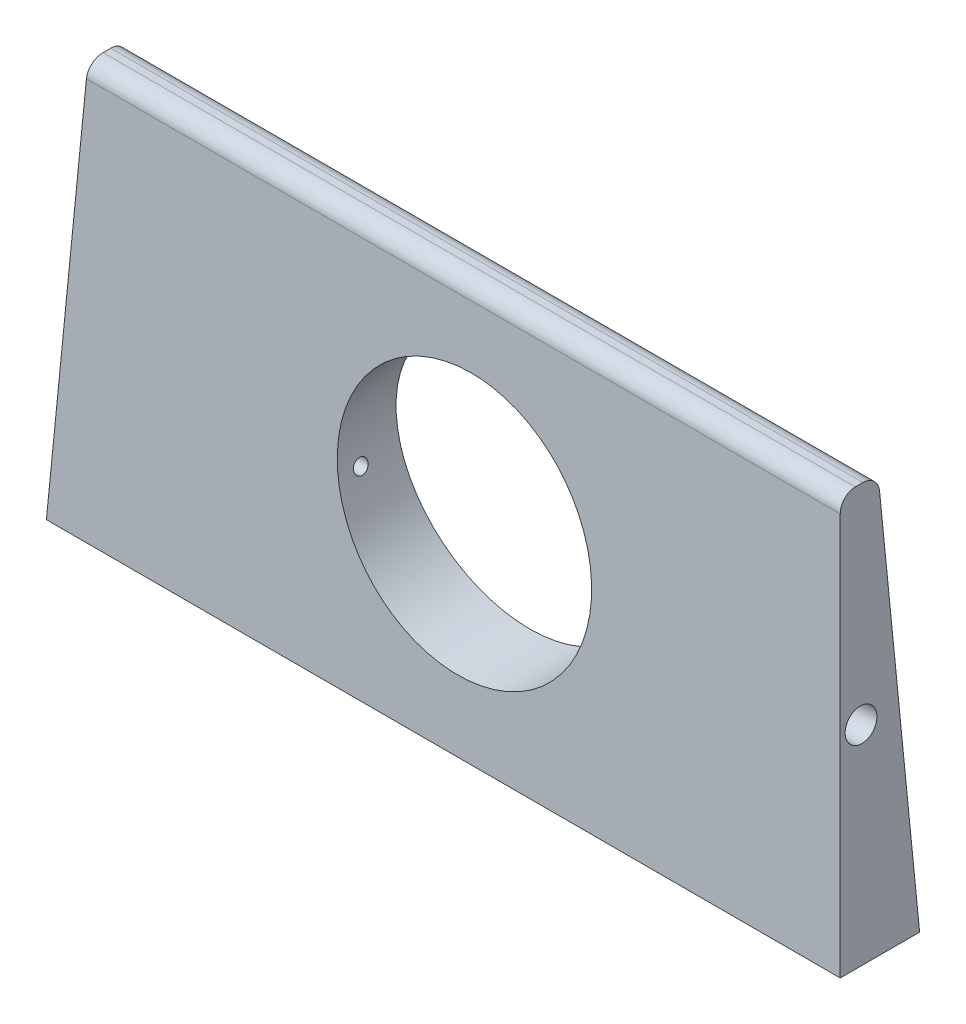
from build123d import *

# Parameters (mm, degrees)
SKETCH1_W           = 100
SKETCH1_H           = 10
BOSS_EXTRUDE1_DEPTH = 50
BOSS_EXTRUDE1_TAPER = 3
FILLET1_R           = 2
SKETCH2_R           = 16
CUT_EXTRUDE1_DEPTH  = 50
SKETCH3_R           = 2
CUT_EXTRUDE2_DEPTH  = 105
CUT_EXTRUDE2_DRAFT  = -1


with BuildPart() as part:
    # Sketch1 → Boss-Extrude1 (new body)
    with BuildSketch(Plane(origin=(0, 0, 0), x_dir=(1, 0, 0), z_dir=(0, 1, 0))):
        Rectangle(SKETCH1_W, SKETCH1_H)
    extrude(amount=BOSS_EXTRUDE1_DEPTH, taper=BOSS_EXTRUDE1_TAPER)

    # Fillet1
    fillet1_edges = [part.edges().sort_by_distance(p)[0] for p in [
        (0, 50, 2.379611036),
        (0, 50, -2.379611036),
    ]]
    fillet(fillet1_edges, radius=FILLET1_R)

    # Sketch2 → Cut-Extrude1 (cut)
    with BuildSketch(Plane(origin=(0, 0.261321158, -4.986304738), x_dir=(-1, 0, 0), z_dir=(0, 0.052335956242943876, -0.998629534754574))):
        with Locations(Location((-1.376828388, 24.738320219, 0), (0, 0, 90))):
            Circle(SKETCH2_R)
    extrude(amount=-CUT_EXTRUDE1_DEPTH, mode=Mode.SUBTRACT)


with BuildPart() as cut_extrude2_tool:
    # Sketch3 → Cut-Extrude2 (with draft: the straight prism first)
    with BuildSketch(Plane(origin=(49.863047384, 2.613211582, 0), x_dir=(0, 0, -1), z_dir=(0.998629534754574, 0.052335956242943876, 0))):
        with Locations((-1.067678457, 22.417510838)):
            Circle(SKETCH3_R)
    extrude(amount=-CUT_EXTRUDE2_DEPTH)
    # Cut-Extrude2: the draft: its side faces are tilted about the plane it starts from
    cut_extrude2_sides = [cut_extrude2_tool.faces().sort_by_distance(p)[0] for p in [
        (-3.738245057, 22.252362297, 3.067678457),
    ]]
    draft(cut_extrude2_sides, Plane(origin=(49.863047384, 2.613211582, 0), x_dir=(0, 0, -1), z_dir=(0.998629534754574, 0.052335956242943876, 0)), CUT_EXTRUDE2_DRAFT)


with BuildPart() as part_1:
    add(part.part)

    # Cut-Extrude2: cut by cut_extrude2_tool
    add(cut_extrude2_tool.part, mode=Mode.SUBTRACT)


solid = part_1.part
